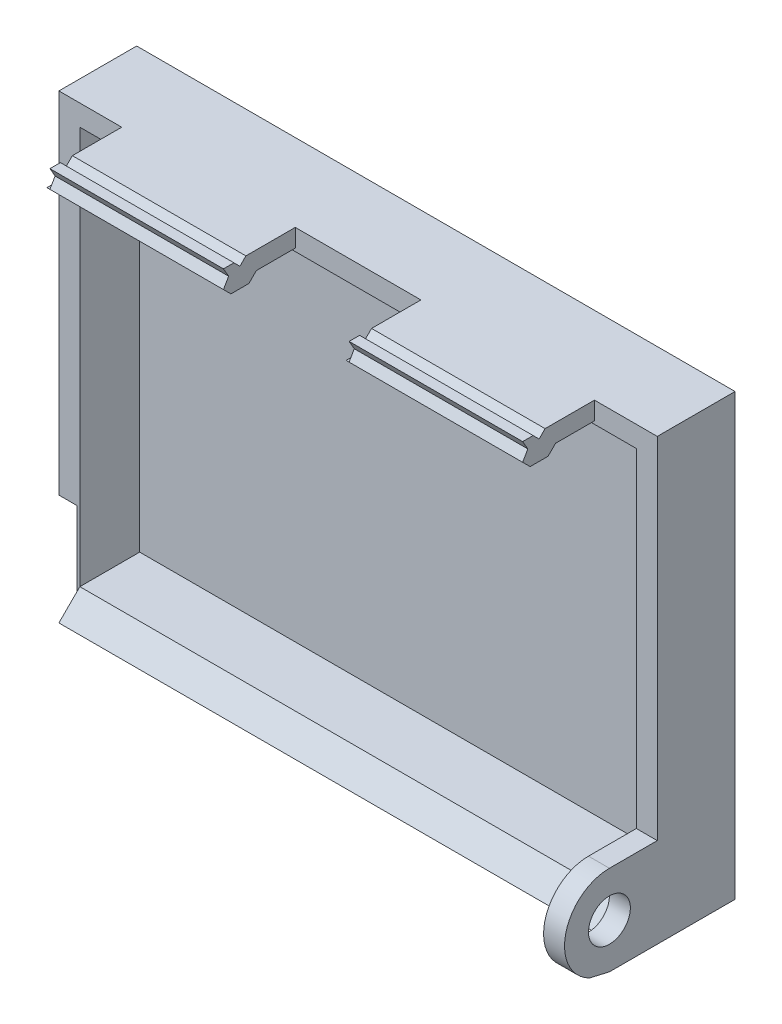
from build123d import *

# Parameters (mm, degrees)
SKETCH1_W            = 100
SKETCH1_H            = 73.5
SKETCH1_W_2          = 93
SKETCH1_H_2          = 66.5
BOSS_EXTRUDE1_DEPTH  = 10
SKETCH2_W            = 100
SKETCH2_H            = 73.5
BOSS_EXTRUDE2_DEPTH  = 3
SKETCH3_R            = 3.5
BOSS_EXTRUDE8_DEPTH  = 3.5
SKETCH4_W            = 12
SKETCH4_H            = 15
CUT_EXTRUDE4_DEPTH   = 3
SKETCH7_W            = 100
SKETCH7_H            = 3
BOSS_EXTRUDE12_DEPTH = 12
SKETCH8_W            = 21
SKETCH8_H            = 3
SKETCH8_W_2          = 10.5
CUT_EXTRUDE2_DEPTH   = 12
BOSS_EXTRUDE13_DEPTH = 29.5
BOSS_EXTRUDE14_DEPTH = 29.5
CUT_EXTRUDE3_DEPTH   = 93.5
BOSS_EXTRUDE15_DEPTH = 93


with BuildPart() as part:
    # Sketch1 → Boss-Extrude1 (new body)
    with BuildSketch(Plane.XY):
        Rectangle(SKETCH1_W, SKETCH1_H)
        Rectangle(SKETCH1_W_2, SKETCH1_H_2, mode=Mode.SUBTRACT)
    extrude(amount=BOSS_EXTRUDE1_DEPTH)

    # Sketch2 → Boss-Extrude2 (add)
    with BuildSketch(Plane(origin=(0, 0, 0), x_dir=(-1, 0, 0), z_dir=(0, 0, -1))):
        Rectangle(SKETCH2_W, SKETCH2_H)
    extrude(amount=BOSS_EXTRUDE2_DEPTH)

    # Sketch3 → Boss-Extrude8 (add)
    with BuildSketch(Plane(origin=(50, 0, 0), x_dir=(0, 0, -1), z_dir=(1, 0, 0))):
        with BuildLine():
            Line((-10, -21.75), (-18, -21.75))
            ThreePointArc((-18, -21.75), (-25.303809073, -27.545777883), (-21.319283456, -35.975500527))
            Line((-21.319283456, -35.975500527), (-18, -36.75))
            Line((-18, -36.75), (-10, -36.75))
            Line((-10, -36.75), (-10, -21.75))
        make_face()
        with Locations(Location((-18, -29.25, 0), (0, 0, 90))):
            Circle(SKETCH3_R, mode=Mode.SUBTRACT)
    extrude(amount=-BOSS_EXTRUDE8_DEPTH)

    # Sketch4 → Cut-Extrude4 (cut)
    with BuildSketch(Plane.ZY.offset(50)):
        with Locations((4, -29.25)):
            Rectangle(SKETCH4_W, SKETCH4_H)
    extrude(amount=-CUT_EXTRUDE4_DEPTH, mode=Mode.SUBTRACT)

    # Sketch7 → Boss-Extrude12 (add)
    with BuildSketch(Plane.XY.offset(10)):
        with Locations((0, 35.25)):
            Rectangle(SKETCH7_W, SKETCH7_H)
    extrude(amount=BOSS_EXTRUDE12_DEPTH)

    # Sketch8 → Cut-Extrude2 (cut)
    with BuildSketch(Plane.XY.offset(22)):
        with Locations((0, 35.25)):
            Rectangle(SKETCH8_W, SKETCH8_H)
        with Locations((-44.75, 35.25)):
            Rectangle(SKETCH8_W_2, SKETCH8_H)
        with Locations((44.75, 35.25)):
            Rectangle(SKETCH8_W_2, SKETCH8_H)
    extrude(amount=-CUT_EXTRUDE2_DEPTH, mode=Mode.SUBTRACT)

    # Sketch9 → Boss-Extrude13 (add)
    with BuildSketch(Plane(origin=(39.5, 0, 0), x_dir=(0, 0, -1), z_dir=(1, 0, 0))):
        Polygon((-22, 33.75), (-20.75, 32.5), (-17.75, 32.5), (-16.5, 33.75), align=None)
    extrude(amount=-BOSS_EXTRUDE13_DEPTH)

    # Sketch10 → Boss-Extrude14 (add)
    with BuildSketch(Plane(origin=(-10.5, 0, 0), x_dir=(0, 0, -1), z_dir=(1, 0, 0))):
        Polygon((-22, 33.75), (-20.75, 32.5), (-17.75, 32.5), (-16.5, 33.75), align=None)
    extrude(amount=-BOSS_EXTRUDE14_DEPTH)

    # Sketch11 → Cut-Extrude3 (cut)
    with BuildSketch(Plane(origin=(39.5, 0, 0), x_dir=(0, 0, -1), z_dir=(1, 0, 0))):
        Polygon((-19.25, 36.75), (-19.25, 35.75), (-18.25, 36.75), align=None)
        Polygon((-19.25, 36.75), (-20.25, 36.75), (-19.25, 35.75), align=None)
        Polygon((-21.133974596, 35.25), (-22, 36.75), (-22, 35.25), align=None)
        Polygon((-22, 33.75), (-21.133974596, 35.25), (-22, 35.25), align=None)
    extrude(amount=-CUT_EXTRUDE3_DEPTH, mode=Mode.SUBTRACT)

    # Sketch12 → Boss-Extrude15 (add)
    with BuildSketch(Plane.ZY.offset(-46.5)):
        Polygon((10, -36.75), (13.5, -36.75), (10, -33.25), align=None)
    extrude(amount=BOSS_EXTRUDE15_DEPTH)


solid = part.part
